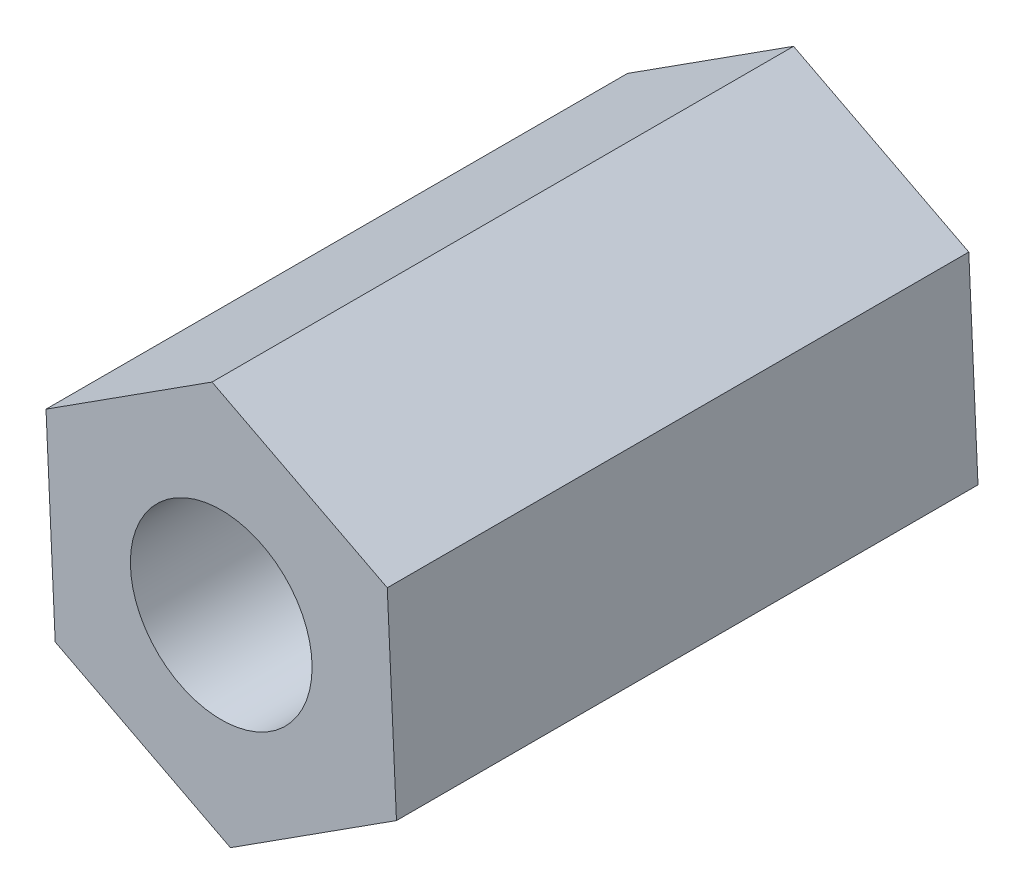
from build123d import *

# Parameters (mm, degrees)
EXTRUDE_1_DEPTH    = 8
HOLE_WIZARD_M3_1_D = 2.5


with BuildPart() as part:
    # 草图1 → 凸台-拉伸1 (new body)
    with BuildSketch(Plane.XY):
        Polygon((-0.126602439, 2.710591293), (-2.410742138, 1.245654718), (-2.284139699, -1.464936574), (0.126602439, -2.710591293), (2.410742138, -1.245654718), (2.284139699, 1.464936574), align=None)
    extrude(amount=EXTRUDE_1_DEPTH)

    # M3 螺纹孔1 (through all)
    with Locations(Plane(origin=(0, 0, 0), x_dir=(-1, 0, 0), z_dir=(0, 0, -1))):
        with Locations((0, 0)):
            Hole(HOLE_WIZARD_M3_1_D / 2)


solid = part.part
